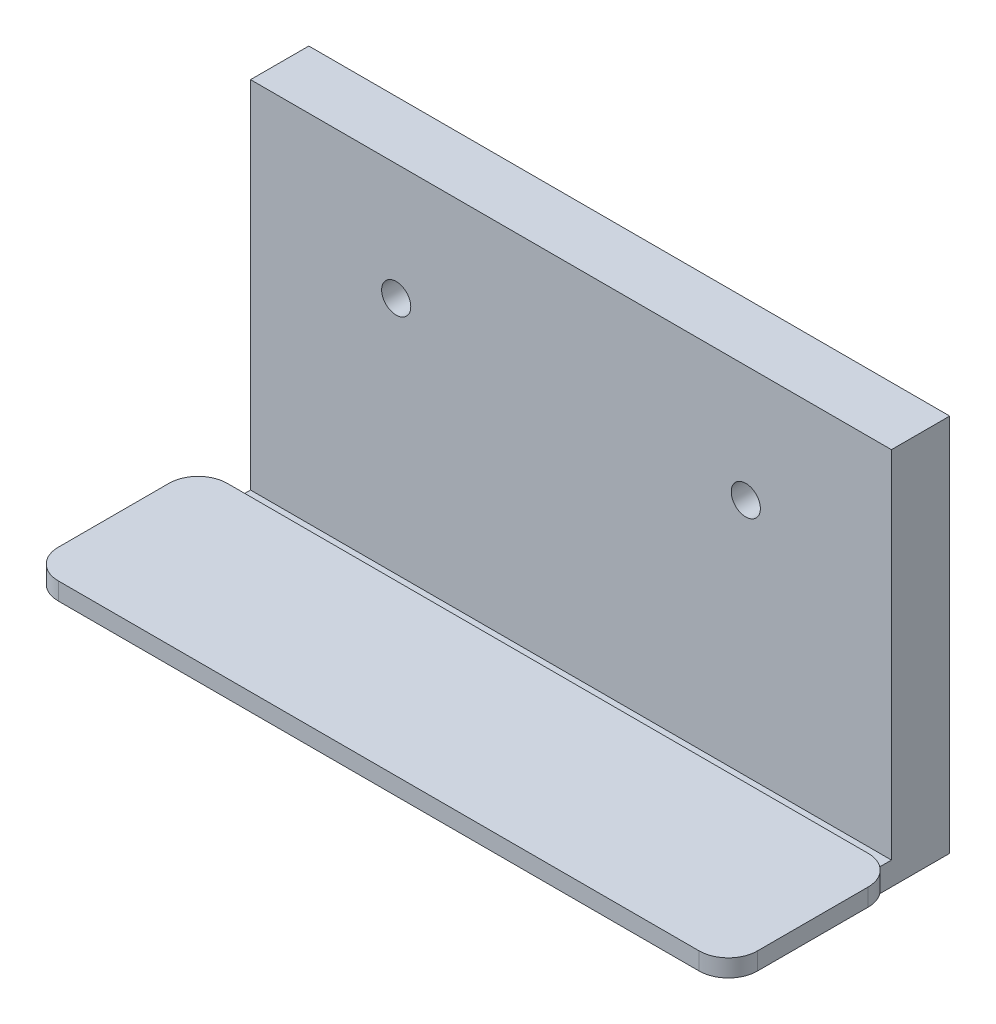
from build123d import *

# Parameters (mm, degrees)
ESQUISSE1_W             = 110
ESQUISSE1_H             = 65
BOSS_EXTRU_1_DEPTH      = 10
ESQUISSE2_W             = 110
ESQUISSE2_H             = 4
BOSS_EXTRU_2_DEPTH      = 20
ESQUISSE3_W             = 120
ESQUISSE3_H             = 29
BOSS_EXTRU_3_DEPTH      = 3
CONG_1_R                = 5
ESQUISSE4_R             = 2.5
ENL_V_MAT_EXTRU_1_DEPTH = 76.797427397


with BuildPart() as part:
    # Esquisse1 → Boss.-Extru.1 (new body)
    with BuildSketch(Plane.XY):
        Rectangle(ESQUISSE1_W, ESQUISSE1_H)
    extrude(amount=BOSS_EXTRU_1_DEPTH)

    # Esquisse2 → Boss.-Extru.2 (add)
    with BuildSketch(Plane.XY.offset(10)):
        with Locations((0, -30.5)):
            Rectangle(ESQUISSE2_W, ESQUISSE2_H)
    extrude(amount=BOSS_EXTRU_2_DEPTH)

    # Esquisse3 → Boss.-Extru.3 (add)
    with BuildSketch(Plane(origin=(0, -28.5, 0), x_dir=(1, 0, 0), z_dir=(0, 1, 0))):
        with Locations((0, -28.5)):
            Rectangle(ESQUISSE3_W, ESQUISSE3_H)
    extrude(amount=BOSS_EXTRU_3_DEPTH)

    # Congé1
    cong_1_edges = [part.edges().sort_by_distance(p)[0] for p in [
        (60, -27, 14),
        (60, -27, 43),
        (-60, -27, 43),
        (-60, -27, 14),
    ]]
    fillet(cong_1_edges, radius=CONG_1_R)

    # Esquisse4 → Enlèv. mat.-Extru.1 (cut, through all)
    with BuildSketch(Plane.XY.offset(10)):
        with Locations((-30, 12.5)):
            Circle(ESQUISSE4_R)
        with Locations((30, 12.5)):
            Circle(ESQUISSE4_R)
    extrude(amount=-ENL_V_MAT_EXTRU_1_DEPTH, mode=Mode.SUBTRACT)


solid = part.part
